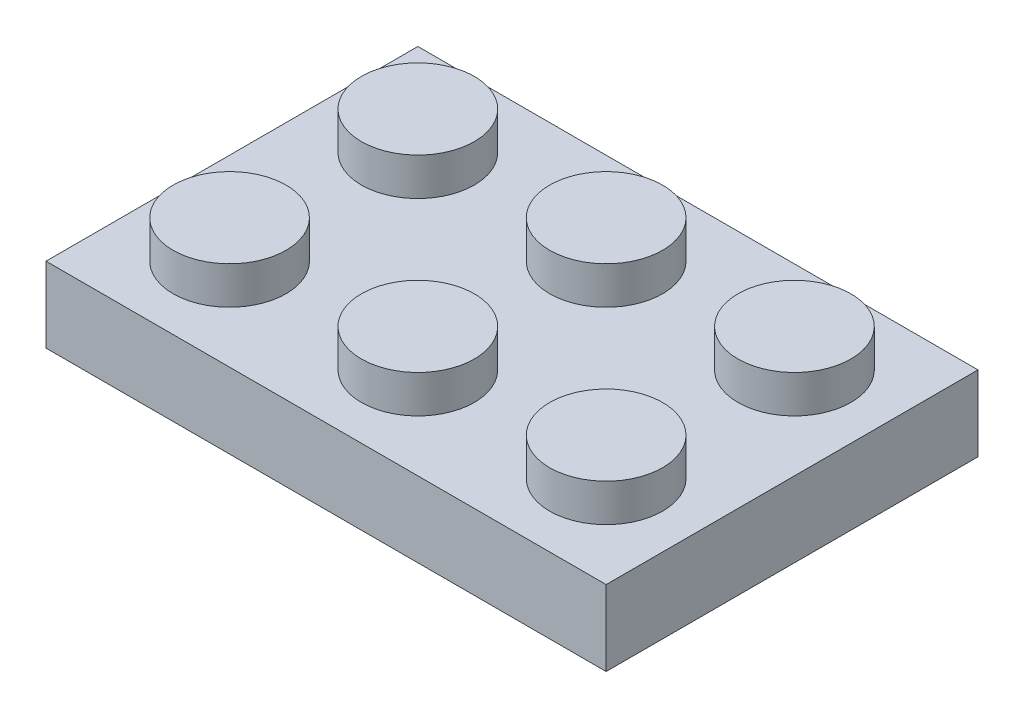
from build123d import *

# Parameters (mm, degrees)
SKETCH1_W            = 23.8
SKETCH1_H            = 3.2
BOSS_EXTRUDE1_DEPTH  = 15.8
SKETCH2_R            = 2.4
BOSS_EXTRUDE2_DEPTH  = 1.6
LPATTERN1_COUNT      = 2
LPATTERN1_PITCH      = 8
LPATTERN1_COUNT_DIR2 = 6
LPATTERN1_PITCH_DIR2 = 8
SHELL1_T             = -1.2
SKETCH3_R            = 3.25
SKETCH3_R_2          = 2.4
BOSS_EXTRUDE3_DEPTH  = 1.8
LPATTERN2_COUNT      = 2
LPATTERN2_PITCH      = 8


with BuildPart() as part:
    # Sketch1 → Boss-Extrude1 (new body)
    with BuildSketch(Plane.XY):
        with Locations((11.9, 1.6)):
            Rectangle(SKETCH1_W, SKETCH1_H)
    extrude(amount=-BOSS_EXTRUDE1_DEPTH)

    # Sketch2 → Boss-Extrude2 (add)
    with BuildSketch(Plane(origin=(0, 3.2, 0), x_dir=(1, 0, 0), z_dir=(0, 1, 0))):
        with Locations(Location((3.9, 3.9, 0), (0, 0, 270))):
            Circle(SKETCH2_R)
    boss_extrude2 = extrude(amount=BOSS_EXTRUDE2_DEPTH)

    # LPattern1: Boss-Extrude2 2 × 6, 6 skipped
    with Locations(*[(j * LPATTERN1_PITCH_DIR2, 0, -i * LPATTERN1_PITCH) for i in range(LPATTERN1_COUNT) for j in range(LPATTERN1_COUNT_DIR2) if (i, j) not in ((0, 0), (0, 3), (0, 4), (0, 5), (1, 3), (1, 4), (1, 5))]):
        add(boss_extrude2)

    # Shell1
    shell1_openings = [part.faces().sort_by_distance(p)[0] for p in [
        (11.9, 0, -7.9),
    ]]
    offset(amount=SHELL1_T, openings=shell1_openings, kind=Kind.INTERSECTION)

    # Sketch3 → Boss-Extrude3 (add)
    with BuildSketch(Plane.XZ.offset(-2)):
        with Locations(Location((7.9, -7.9, 0), (0, 0, 90))):
            Circle(SKETCH3_R)
        with Locations(Location((7.9, -7.9, 0), (0, 0, 270))):
            Circle(SKETCH3_R_2, mode=Mode.SUBTRACT)
    boss_extrude3 = extrude(amount=BOSS_EXTRUDE3_DEPTH)

    # LPattern2: Boss-Extrude3 ×2
    with Locations(*[(i * LPATTERN2_PITCH, 0, 0) for i in range(1, LPATTERN2_COUNT)]):
        add(boss_extrude3)


solid = part.part
